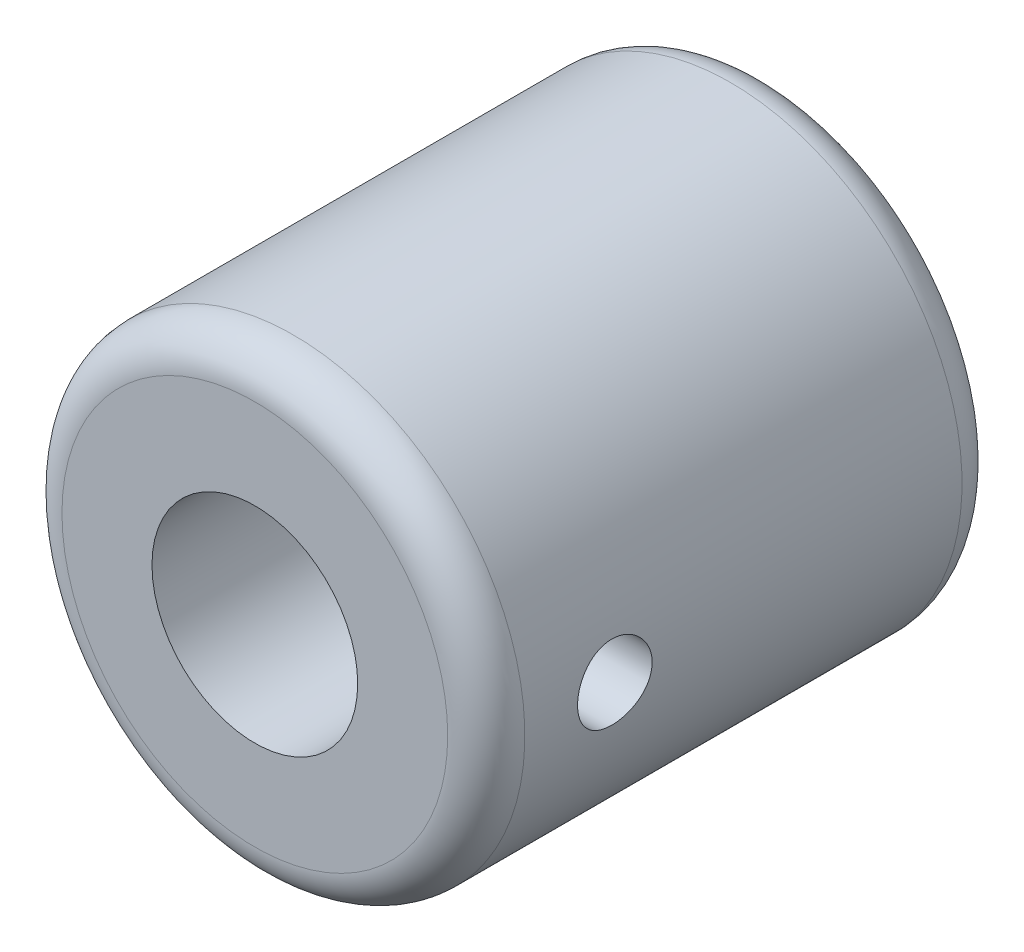
from build123d import *

# Parameters (mm, degrees)
F_8_0_8_DIAMETER_HOLE1_D     = 8
F_8_0_8_DIAMETER_HOLE1_DEPTH = 10
SKETCH4_W                    = 1.45
SKETCH4_H                    = 18


with BuildPart() as part:
    # Sketch1 → Revolve1 (revolve)
    with BuildSketch(Plane.XZ, mode=Mode.PRIVATE) as revolve1_sk:
        with BuildLine():
            Line((7.5, 20), (0, 20))
            Line((0, 20), (0, 0))
            Line((0, 0), (7.5, 0))
            ThreePointArc((7.5, 0), (8.560660172, 0.439339828), (9, 1.5))
            Line((9, 1.5), (9, 18.5))
            ThreePointArc((9, 18.5), (8.560660172, 19.560660172), (7.5, 20))
        make_face()
    revolve(revolve1_sk.sketch.rotate(Axis((0, 0, 20), (0, 0, -1)), 180), axis=Axis((0, 0, 20), (0, 0, -1)))

    # Ø8.0 (8) Diameter Hole1
    with Locations(Plane.XY.offset(20)):
        with Locations((0, 0)):
            Hole(F_8_0_8_DIAMETER_HOLE1_D / 2, depth=F_8_0_8_DIAMETER_HOLE1_DEPTH)

    # Sketch4 → Ø2.9 (2.9) Diameter Hole1 (revolve, cut)
    with BuildSketch(Plane(origin=(3.727935085, 0, 15), x_dir=(0, 0, 1), z_dir=(0, 1, 0))):
        with Locations((0.725, 9)):
            Rectangle(SKETCH4_W, SKETCH4_H)
    revolve(axis=Axis((-2.622064915, 0, 15), (1, 0, 0)), mode=Mode.SUBTRACT)


solid = part.part
